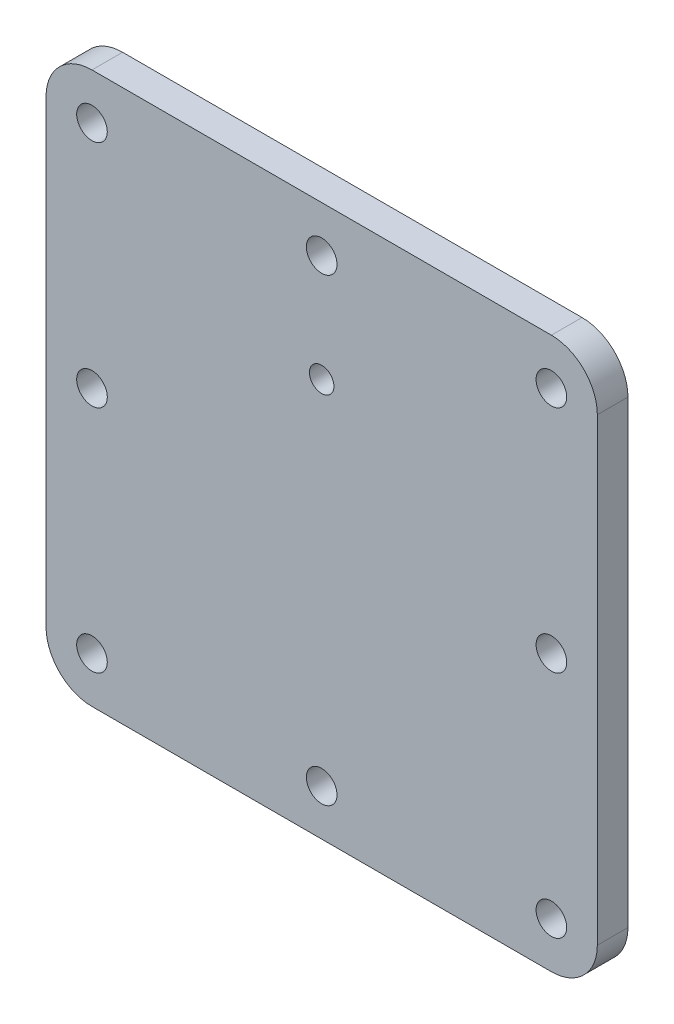
from build123d import *

# Parameters (mm, degrees)
SKETCH2_R           = 5
BOSS_EXTRUDE1_DEPTH = 10
SKETCH5_R           = 4
CUT_EXTRUDE2_DEPTH  = 10


with BuildPart() as part:
    # Sketch2 → Boss-Extrude1 (new body)
    with BuildSketch(Plane.XY):
        with BuildLine():
            Line((-75, 90), (75, 90))
            ThreePointArc((75, 90), (85.606601718, 85.606601718), (90, 75))
            Line((90, 75), (90, -75))
            ThreePointArc((90, -75), (85.606601718, -85.606601718), (75, -90))
            Line((75, -90), (-75, -90))
            ThreePointArc((-75, -90), (-85.606601718, -85.606601718), (-90, -75))
            Line((-90, -75), (-90, 75))
            ThreePointArc((-90, 75), (-85.606601718, 85.606601718), (-75, 90))
        make_face()
        with Locations((-75, 75)):
            Circle(SKETCH2_R, mode=Mode.SUBTRACT)
        with Locations((0, 75)):
            Circle(SKETCH2_R, mode=Mode.SUBTRACT)
        with Locations((75, 75)):
            Circle(SKETCH2_R, mode=Mode.SUBTRACT)
        with Locations((-75, 0)):
            Circle(SKETCH2_R, mode=Mode.SUBTRACT)
        with Locations((75, 0)):
            Circle(SKETCH2_R, mode=Mode.SUBTRACT)
        with Locations((-75, -75)):
            Circle(SKETCH2_R, mode=Mode.SUBTRACT)
        with Locations((0, -75)):
            Circle(SKETCH2_R, mode=Mode.SUBTRACT)
        with Locations((75, -75)):
            Circle(SKETCH2_R, mode=Mode.SUBTRACT)
    extrude(amount=BOSS_EXTRUDE1_DEPTH)

    # Sketch5 → Cut-Extrude2 (cut)
    with BuildSketch(Plane.XY.offset(10)):
        with Locations((0, 40)):
            Circle(SKETCH5_R)
    extrude(amount=-CUT_EXTRUDE2_DEPTH, mode=Mode.SUBTRACT)


solid = part.part
